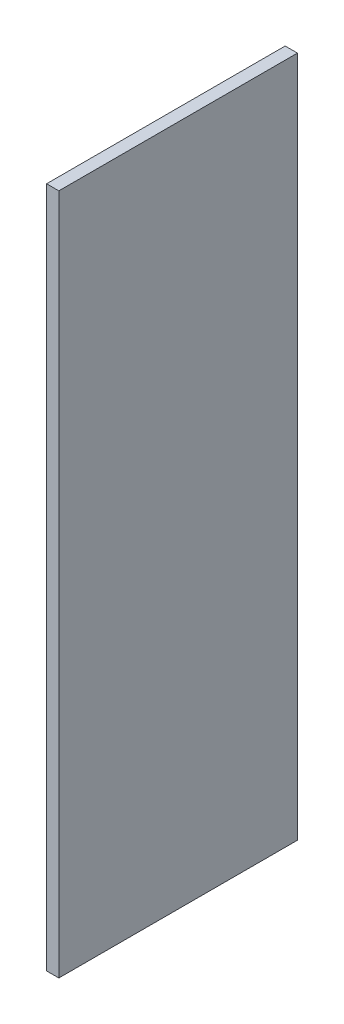
from build123d import *

# Parameters (mm, degrees)
SKETCH1_W           = 350
SKETCH1_H           = 1000
BOSS_EXTRUDE1_DEPTH = 18


with BuildPart() as part:
    # Sketch1 → Boss-Extrude1 (new body)
    with BuildSketch(Plane(origin=(0, 0, 0), x_dir=(0, 0, -1), z_dir=(1, 0, 0))):
        Rectangle(SKETCH1_W, SKETCH1_H)
    extrude(amount=BOSS_EXTRUDE1_DEPTH)


solid = part.part
